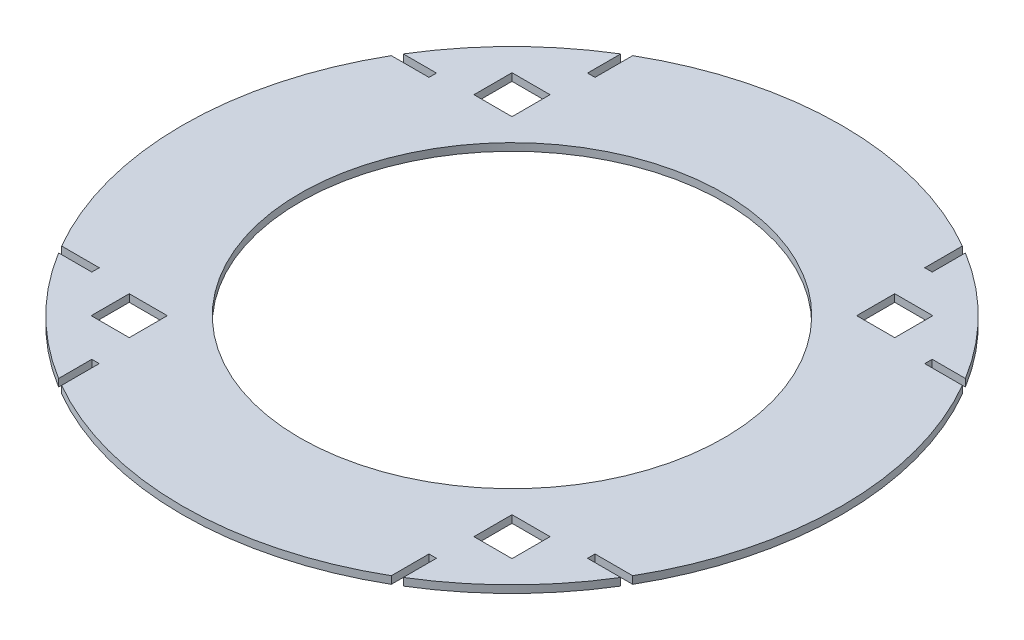
from build123d import *

# Parameters (mm, degrees)
SKETCH1_R           = 141.421356237
SKETCH1_W           = 25.4
SKETCH1_H           = 25.4
BOSS_EXTRUDE1_DEPTH = 5


with BuildPart() as part:
    # Sketch1 → Boss-Extrude1 (new body)
    with BuildSketch(Plane(origin=(0, 0, 0), x_dir=(1, 0, 0), z_dir=(0, 1, 0))):
        with BuildLine():
            Line((115, 165.4), (110, 165.4))
            Line((110, 165.4), (110, 190.525588833))
            ThreePointArc((110, 190.525588833), (0, 220), (-110, 190.525588833))
            Line((-110, 190.525588833), (-110, 165.4))
            Line((-110, 165.4), (-115, 165.4))
            Line((-115, 165.4), (-115, 187.549993335))
            ThreePointArc((-115, 187.549993335), (-155.563491861, 155.563491861), (-187.549993335, 115))
            Line((-187.549993335, 115), (-165.4, 115))
            Line((-165.4, 115), (-165.4, 110))
            Line((-165.4, 110), (-190.525588833, 110))
            ThreePointArc((-190.525588833, 110), (-220, 0), (-190.525588833, -110))
            Line((-190.525588833, -110), (-165.4, -110))
            Line((-165.4, -110), (-165.4, -115))
            Line((-165.4, -115), (-187.549993335, -115))
            ThreePointArc((-187.549993335, -115), (-155.563491861, -155.563491861), (-115, -187.549993335))
            Line((-115, -187.549993335), (-115, -165.4))
            Line((-115, -165.4), (-110, -165.4))
            Line((-110, -165.4), (-110, -190.525588833))
            ThreePointArc((-110, -190.525588833), (0, -220), (110, -190.525588833))
            Line((110, -190.525588833), (110, -165.4))
            Line((110, -165.4), (115, -165.4))
            Line((115, -165.4), (115, -187.549993335))
            ThreePointArc((115, -187.549993335), (155.563491861, -155.563491861), (187.549993335, -115))
            Line((187.549993335, -115), (165.4, -115))
            Line((165.4, -115), (165.4, -110))
            Line((165.4, -110), (190.525588833, -110))
            ThreePointArc((190.525588833, -110), (220, 0), (190.525588833, 110))
            Line((190.525588833, 110), (165.4, 110))
            Line((165.4, 110), (165.4, 115))
            Line((165.4, 115), (187.549993335, 115))
            ThreePointArc((187.549993335, 115), (155.563491861, 155.563491861), (115, 187.549993335))
            Line((115, 187.549993335), (115, 165.4))
        make_face()
        with Locations(Location((0, 0, 0), (0, 0, 270))):
            Circle(SKETCH1_R, mode=Mode.SUBTRACT)
        with Locations((127.7, 127.7)):
            Rectangle(SKETCH1_W, SKETCH1_H, mode=Mode.SUBTRACT)
        with Locations((-127.7, 127.7)):
            Rectangle(SKETCH1_W, SKETCH1_H, mode=Mode.SUBTRACT)
        with Locations((127.7, -127.7)):
            Rectangle(SKETCH1_W, SKETCH1_H, mode=Mode.SUBTRACT)
        with Locations((-127.7, -127.7)):
            Rectangle(SKETCH1_W, SKETCH1_H, mode=Mode.SUBTRACT)
    extrude(amount=BOSS_EXTRUDE1_DEPTH)


solid = part.part
